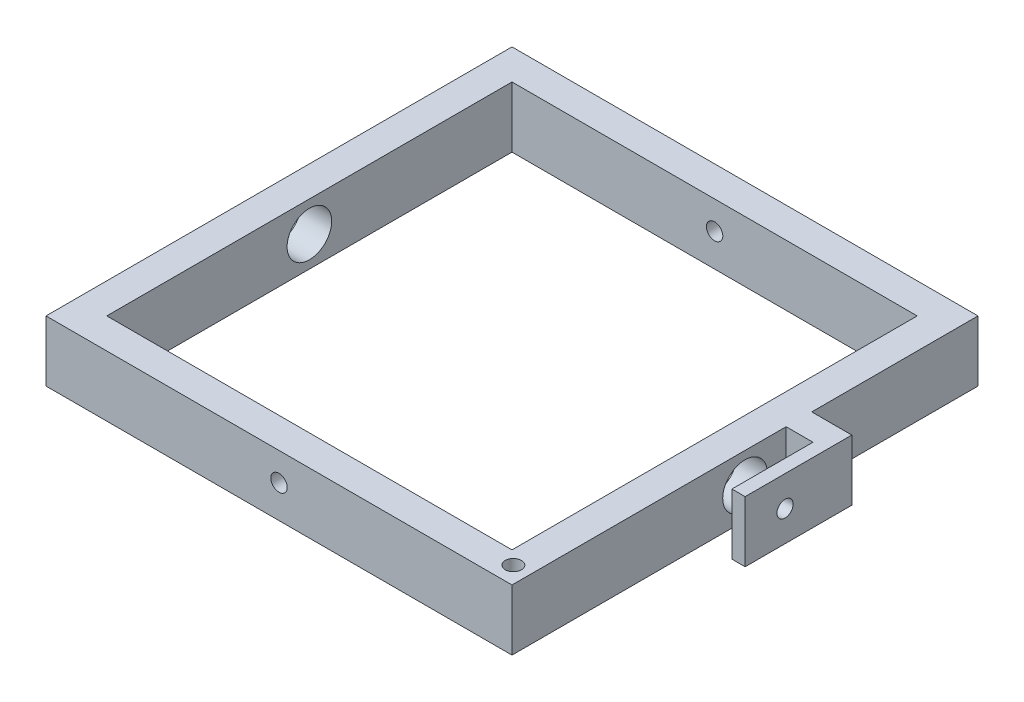
from build123d import *

# Parameters (mm, degrees)
SKETCH1_W           = 230
SKETCH1_H           = 230
SKETCH1_W_2         = 200
SKETCH1_H_2         = 200
BOSS_EXTRUDE1_DEPTH = 30
SKETCH2_R           = 11
CUT_EXTRUDE3_DEPTH  = 206
SKETCH3_W           = 12.648408852
SKETCH3_H           = 30
BOSS_EXTRUDE2_DEPTH = 28
SKETCH4_W           = 33.277006623
SKETCH4_H           = 30
BOSS_EXTRUDE4_DEPTH = 41
SKETCH6_R           = 4
CUT_EXTRUDE4_DEPTH  = 218
SKETCH8_R           = 4.046690546
CUT_EXTRUDE6_DEPTH  = 280
CUT_EXTRUDE7_START  = -230
SKETCH9_R           = 11
CUT_EXTRUDE7_DEPTH  = 230
SKETCH11_W          = 19.776160892
SKETCH11_H          = 30
CUT_EXTRUDE8_DEPTH  = 41
SKETCH12_R          = 4
CUT_EXTRUDE9_DEPTH  = 264
SKETCH13_R          = 4
CUT_EXTRUDE10_DEPTH = 264
SKETCH15_W          = 8.223839108
SKETCH15_H          = 30
CUT_EXTRUDE11_DEPTH = 64
SKETCH16_W          = 6.512440182
SKETCH16_H          = 30
BOSS_EXTRUDE5_DEPTH = 40
SKETCH17_R          = 4
CUT_EXTRUDE12_DEPTH = 276


with BuildPart() as part:
    # Sketch1 → Boss-Extrude1 (new body)
    with BuildSketch(Plane(origin=(0, 0, 0), x_dir=(1, 0, 0), z_dir=(0, 1, 0))):
        Rectangle(SKETCH1_W, SKETCH1_H)
        Rectangle(SKETCH1_W_2, SKETCH1_H_2, mode=Mode.SUBTRACT)
    extrude(amount=BOSS_EXTRUDE1_DEPTH)

    # Sketch2 → Cut-Extrude3 (cut)
    with BuildSketch(Plane(origin=(115, 0, 0), x_dir=(0, 0, -1), z_dir=(1, 0, 0))):
        with Locations((0, 15)):
            Circle(SKETCH2_R)
    extrude(amount=-CUT_EXTRUDE3_DEPTH, mode=Mode.SUBTRACT)

    # Sketch3 → Boss-Extrude2 (add)
    with BuildSketch(Plane(origin=(115, 0, 0), x_dir=(0, 0, -1), z_dir=(1, 0, 0))):
        with Locations((26.610788675, 15)):
            Rectangle(SKETCH3_W, SKETCH3_H)
    extrude(amount=BOSS_EXTRUDE2_DEPTH)

    # Sketch4 → Boss-Extrude4 (add)
    with BuildSketch(Plane.XY.offset(-20.286584249)):
        with Locations((126.361496689, 15)):
            Rectangle(SKETCH4_W, SKETCH4_H)
    extrude(amount=BOSS_EXTRUDE4_DEPTH)

    # Sketch6 → Cut-Extrude4 (cut)
    with BuildSketch(Plane.ZY.offset(115)):
        with Locations((0, 15)):
            Circle(SKETCH6_R)
    extrude(amount=-CUT_EXTRUDE4_DEPTH, mode=Mode.SUBTRACT)

    # Sketch8 → Cut-Extrude6 (cut)
    with BuildSketch(Plane.XY.offset(115)):
        with Locations((0, 16.175919114)):
            Circle(SKETCH8_R)
    extrude(amount=-CUT_EXTRUDE6_DEPTH, mode=Mode.SUBTRACT)

    # Sketch9 → Cut-Extrude7 (cut)
    with BuildSketch(Plane.ZY.offset(115).offset(CUT_EXTRUDE7_START)):
        with Locations((0, 15)):
            Circle(SKETCH9_R)
    extrude(amount=CUT_EXTRUDE7_DEPTH, mode=Mode.SUBTRACT)

    # Sketch11 → Cut-Extrude8 (cut)
    with BuildSketch(Plane.XY.offset(20.713415751)):
        with Locations((124.888080446, 15)):
            Rectangle(SKETCH11_W, SKETCH11_H)
    extrude(amount=-CUT_EXTRUDE8_DEPTH, mode=Mode.SUBTRACT)

    # Sketch12 → Cut-Extrude9 (cut)
    with BuildSketch(Plane.ZY.offset(115)):
        with Locations((0, 15)):
            Circle(SKETCH12_R)
    extrude(amount=-CUT_EXTRUDE9_DEPTH, mode=Mode.SUBTRACT)

    # Sketch13 → Cut-Extrude10 (cut)
    with BuildSketch(Plane(origin=(0, 30, 0), x_dir=(1, 0, 0), z_dir=(0, 1, 0))):
        with Locations(Location((106.851068212, -106.17718303, 0), (0, 0, 270))):
            Circle(SKETCH13_R)
    extrude(amount=-CUT_EXTRUDE10_DEPTH, mode=Mode.SUBTRACT)

    # Sketch15 → Cut-Extrude11 (cut)
    with BuildSketch(Plane.XY.offset(20.713415751)):
        with Locations((138.888080446, 15)):
            Rectangle(SKETCH15_W, SKETCH15_H)
    extrude(amount=-CUT_EXTRUDE11_DEPTH, mode=Mode.SUBTRACT)

    # Sketch16 → Boss-Extrude5 (add)
    with BuildSketch(Plane.XY.offset(-20.286584249)):
        with Locations((131.519940801, 15)):
            Rectangle(SKETCH16_W, SKETCH16_H)
    extrude(amount=BOSS_EXTRUDE5_DEPTH)

    # Sketch17 → Cut-Extrude12 (cut)
    with BuildSketch(Plane.ZY.offset(115)):
        with Locations((0, 15)):
            Circle(SKETCH17_R)
    extrude(amount=-CUT_EXTRUDE12_DEPTH, mode=Mode.SUBTRACT)


solid = part.part
